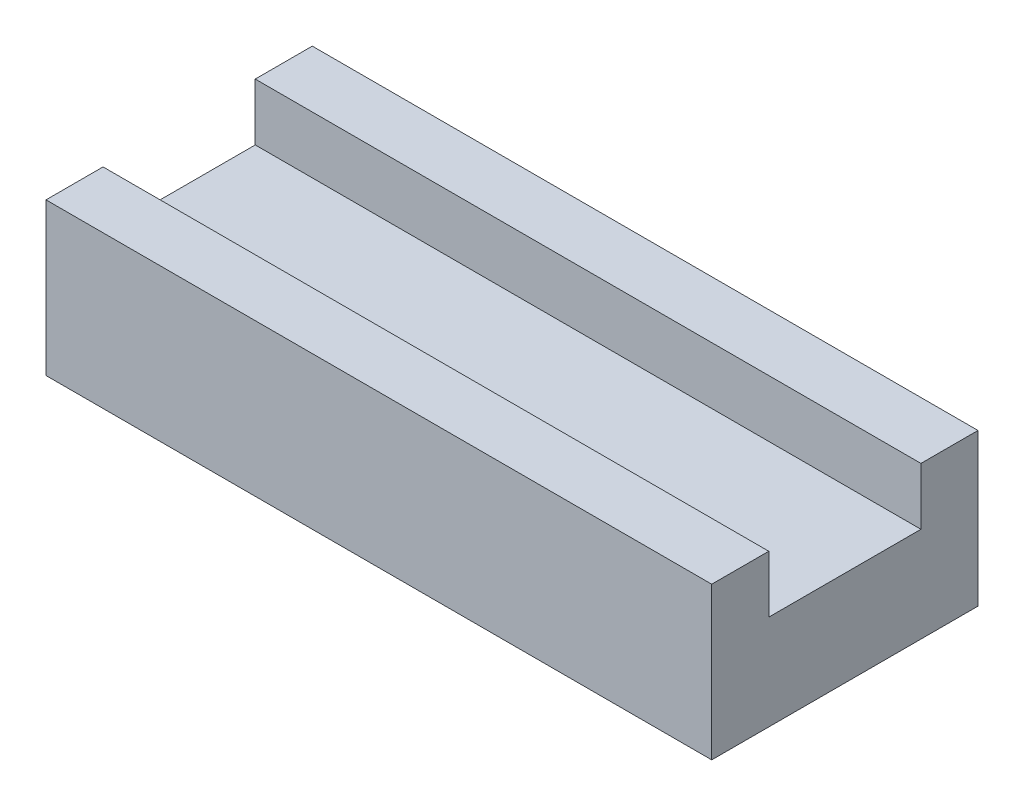
from build123d import *

# Parameters (mm, degrees)
BOSS_EXTRUDE1_DEPTH = 35


with BuildPart() as part:
    # Sketch1 → Boss-Extrude1 (new body)
    with BuildSketch(Plane(origin=(0, 0, 0), x_dir=(0, 0, -1), z_dir=(1, 0, 0))):
        Polygon((-7, 2.5), (-7, 5.5), (-4, 5.5), (-4, 2.5), (4, 2.5), (4, 5.5), (7, 5.5), (7, 2.5), (7, -2.5), (-7, -2.5), align=None)
    extrude(amount=-BOSS_EXTRUDE1_DEPTH)


solid = part.part
